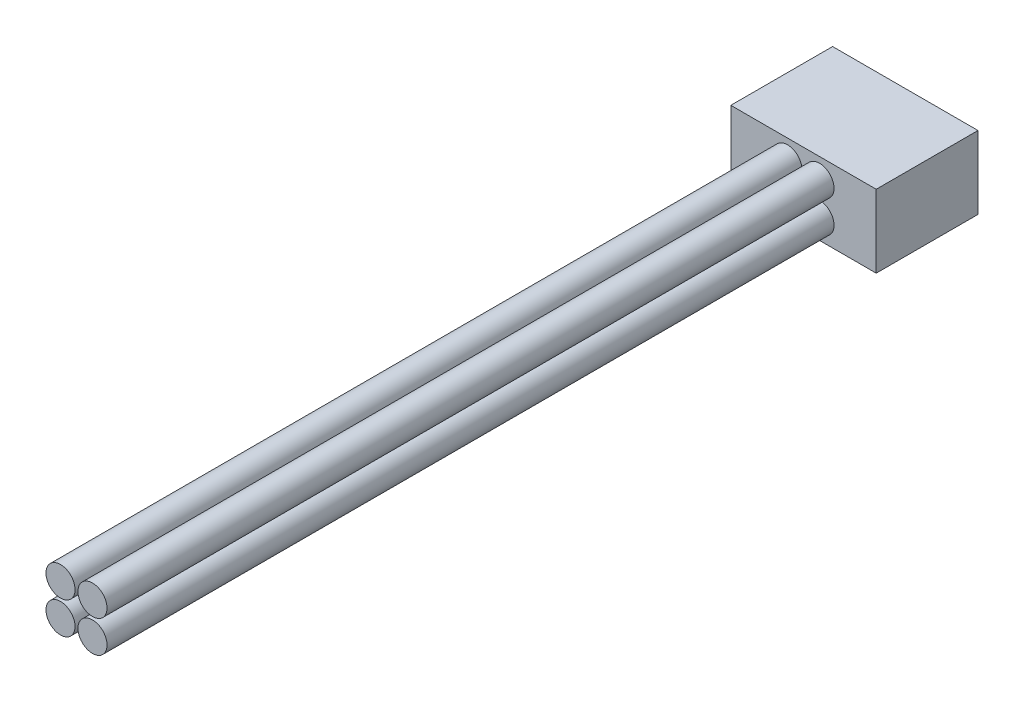
from build123d import *

# Parameters (mm, degrees)
SKETCH1_W           = 10
SKETCH1_H           = 5
BOSS_EXTRUDE1_DEPTH = 7
SKETCH2_R           = 1
BOSS_EXTRUDE5_DEPTH = 50


with BuildPart() as part:
    # Sketch1 → Boss-Extrude1 (new body)
    with BuildSketch(Plane.XY):
        with Locations((-4.92110163, 3.494858358)):
            Rectangle(SKETCH1_W, SKETCH1_H)
    extrude(amount=BOSS_EXTRUDE1_DEPTH)

    # Sketch2 → Boss-Extrude5 (add)
    with BuildSketch(Plane.XY.offset(7)):
        with Locations((-3.82110163, 4.594858358)):
            Circle(SKETCH2_R)
        with Locations((-3.82110163, 2.394858358)):
            Circle(SKETCH2_R)
        with Locations((-6.02110163, 4.594858358)):
            Circle(SKETCH2_R)
        with Locations((-6.02110163, 2.394858358)):
            Circle(SKETCH2_R)
    extrude(amount=BOSS_EXTRUDE5_DEPTH)


solid = part.part
